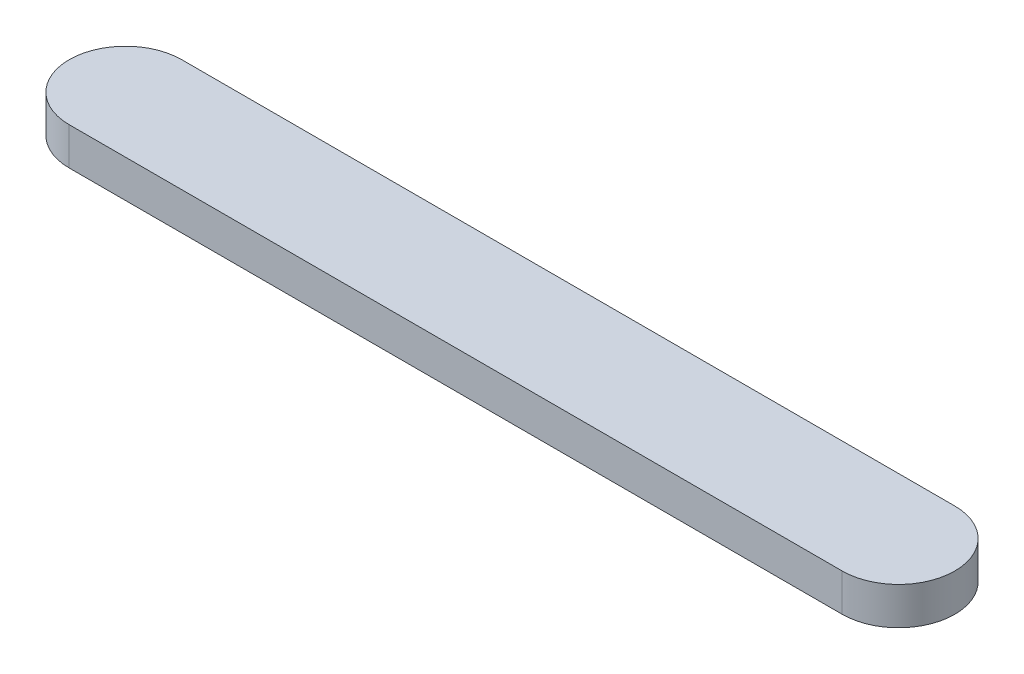
from build123d import *

# Parameters (mm, degrees)
BOSS_EXTRU_1_DEPTH = 10


with BuildPart() as part:
    # Esquisse1 → Boss.-Extru.1 (new body)
    with BuildSketch(Plane(origin=(0, 0, 0), x_dir=(1, 0, 0), z_dir=(0, 1, 0))):
        with BuildLine():
            Line((-103, -15), (103, -15))
            ThreePointArc((103, -15), (118, 0), (103, 15))
            Line((103, 15), (-103, 15))
            ThreePointArc((-103, 15), (-118, 0), (-103, -15))
        make_face()
    extrude(amount=BOSS_EXTRU_1_DEPTH)


solid = part.part
